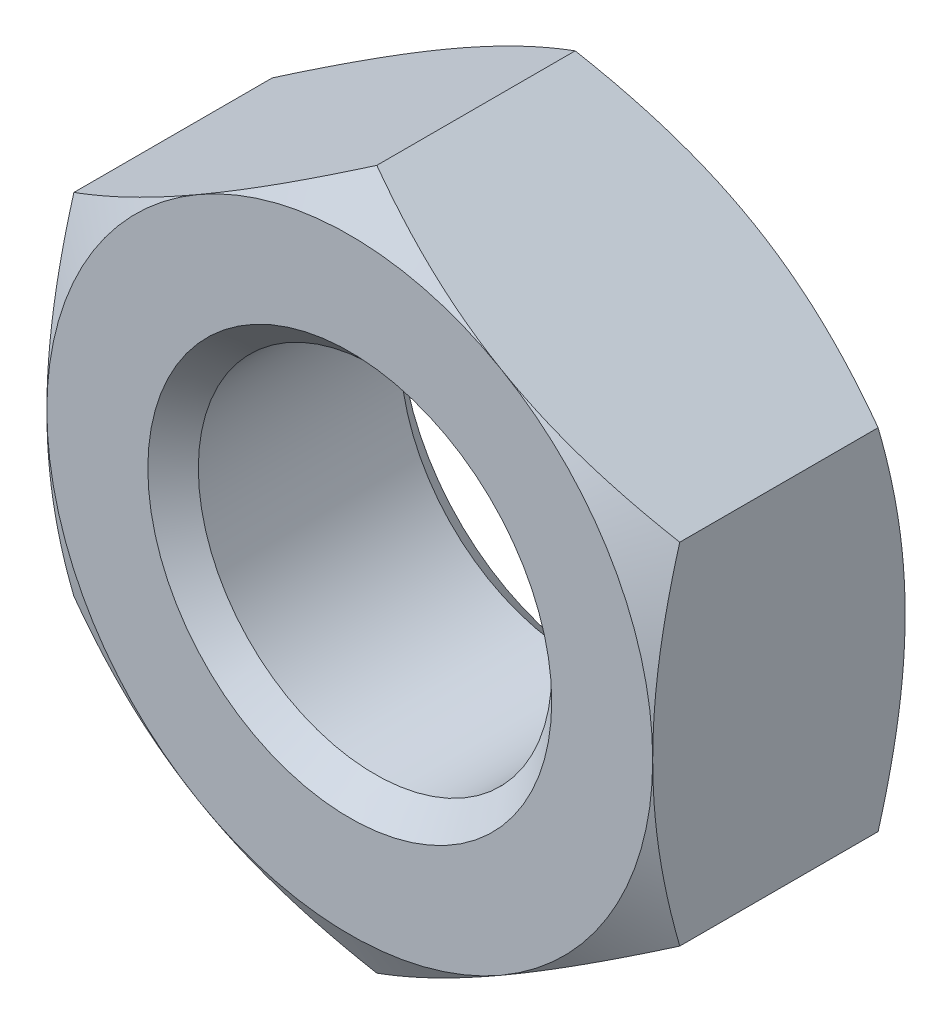
from build123d import *

# Parameters (mm, degrees)
BOSS_EXTRUDE2_DEPTH = 10
SKETCH2_R           = 7
CUT_EXTRUDE1_DEPTH  = 21.880613018
SKETCH3_OUTSIDE_W   = 68.242
SKETCH3_OUTSIDE_H   = 71.954
SKETCH3_OUTSIDE_R   = 12
CUT_EXTRUDE2_DEPTH  = 10
CUT_EXTRUDE2_DRAFT  = -60
SKETCH4_OUTSIDE_W   = 68.242
SKETCH4_OUTSIDE_H   = 71.954
SKETCH4_OUTSIDE_R   = 12
CUT_EXTRUDE3_DEPTH  = 10
CUT_EXTRUDE3_DRAFT  = -60
CHAMFER1_SIZE       = 1


with BuildPart() as part:
    # Sketch1 → Boss-Extrude2 (new body)
    with BuildSketch(Plane.XY):
        Polygon((12, -6.92820323), (12, 6.92820323), (0, 13.856406461), (-12, 6.92820323), (-12, -6.92820323), (0, -13.856406461), align=None)
    extrude(amount=BOSS_EXTRUDE2_DEPTH)

    # Sketch2 → Cut-Extrude1 (cut, through all)
    with BuildSketch(Plane.XY.offset(10)):
        Circle(SKETCH2_R)
    extrude(amount=-CUT_EXTRUDE1_DEPTH, mode=Mode.SUBTRACT)


with BuildPart() as cut_extrude2_tool:
    # Sketch3 outside → Cut-Extrude2 (with draft: the straight prism first)
    with BuildSketch(Plane.XY.offset(10)):
        Rectangle(SKETCH3_OUTSIDE_W, SKETCH3_OUTSIDE_H)
        Circle(SKETCH3_OUTSIDE_R, mode=Mode.SUBTRACT)
    extrude(amount=-CUT_EXTRUDE2_DEPTH)
    # Cut-Extrude2: the draft: its side faces are tilted about the plane it starts from
    cut_extrude2_sides = [cut_extrude2_tool.faces().sort_by_distance(p)[0] for p in [
        (0, -35.977, 5),
        (34.121, 0, 5),
        (0, 35.977, 5),
        (-34.121, 0, 5),
        (-12, 0, 5),
    ]]
    draft(cut_extrude2_sides, Plane.XY.offset(10), CUT_EXTRUDE2_DRAFT)


with BuildPart() as part_1:
    add(part.part)

    # Cut-Extrude2: cut by cut_extrude2_tool
    add(cut_extrude2_tool.part, mode=Mode.SUBTRACT)


with BuildPart() as cut_extrude3_tool:
    # Sketch4 outside → Cut-Extrude3 (with draft: the straight prism first)
    with BuildSketch(Plane(origin=(0, 0, 0), x_dir=(-1, 0, 0), z_dir=(0, 0, -1))):
        Rectangle(SKETCH4_OUTSIDE_W, SKETCH4_OUTSIDE_H)
        Circle(SKETCH4_OUTSIDE_R, mode=Mode.SUBTRACT)
    extrude(amount=-CUT_EXTRUDE3_DEPTH)
    # Cut-Extrude3: the draft: its side faces are tilted about the plane it starts from
    cut_extrude3_sides = [cut_extrude3_tool.faces().sort_by_distance(p)[0] for p in [
        (0, -35.977, 5),
        (-34.121, 0, 5),
        (0, 35.977, 5),
        (34.121, 0, 5),
        (12, 0, 5),
    ]]
    draft(cut_extrude3_sides, Plane(origin=(0, 0, 0), x_dir=(-1, 0, 0), z_dir=(0, 0, -1)), CUT_EXTRUDE3_DRAFT)


with BuildPart() as part_2:
    add(part_1.part)

    # Cut-Extrude3: cut by cut_extrude3_tool
    add(cut_extrude3_tool.part, mode=Mode.SUBTRACT)

    # Chamfer1
    chamfer1_edges = [part_2.edges().sort_by_distance(p)[0] for p in [
        (-7, 0, 0),
        (-7, 0, 10),
    ]]
    chamfer(chamfer1_edges, length=CHAMFER1_SIZE)


solid = part_2.part
